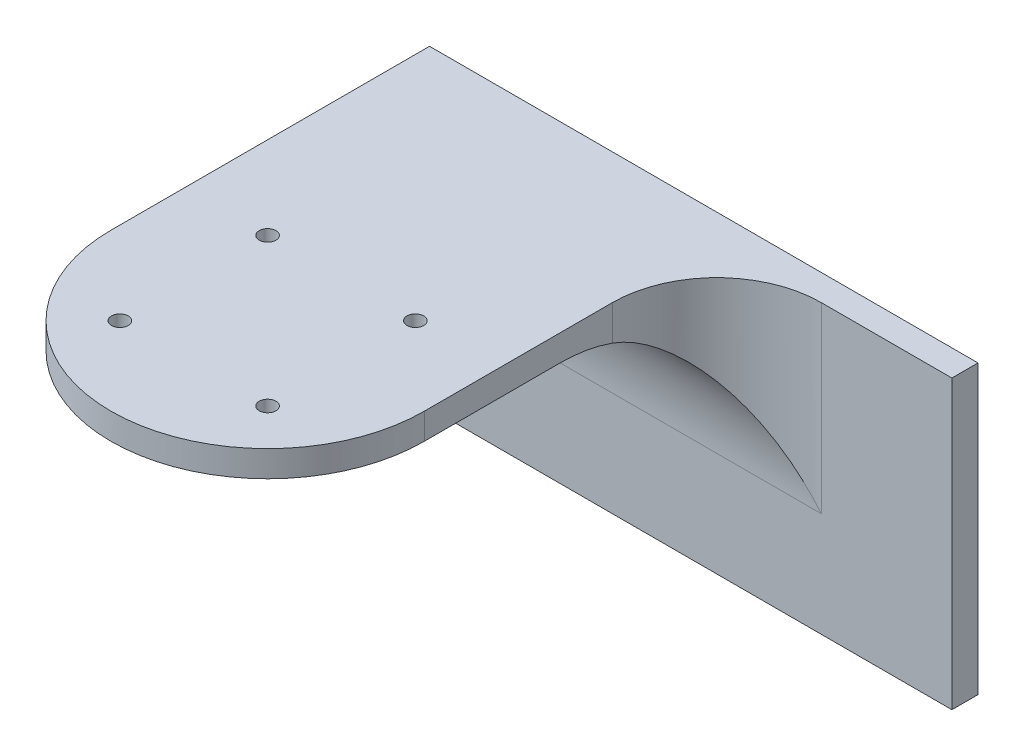
from build123d import *

# Parameters (mm, degrees)
SKETCH1_R           = 30
SKETCH1_R_2         = 1.6
BOSS_EXTRUDE1_DEPTH = 5
BOSS_EXTRUDE2_DEPTH = 5
SKETCH3_W           = 60
SKETCH3_H           = 5
BOSS_EXTRUDE3_DEPTH = 50
FILLET1_R           = 30
SKETCH4_W           = 5
SKETCH4_H           = 55
BOSS_EXTRUDE4_DEPTH = 45
FILLET2_R           = 20


with BuildPart() as part:
    # Sketch1 → Boss-Extrude1 (new body)
    with BuildSketch(Plane(origin=(0, 0, 0), x_dir=(1, 0, 0), z_dir=(0, 1, 0))):
        with Locations(Location((0, 0, 0), (0, 0, 270))):
            Circle(SKETCH1_R)
        with Locations(Location((14.142135624, 14.142135624, 0), (0, 0, 270))):
            Circle(SKETCH1_R_2, mode=Mode.SUBTRACT)
        with Locations(Location((-14.142135624, 14.142135624, 0), (0, 0, 270))):
            Circle(SKETCH1_R_2, mode=Mode.SUBTRACT)
        with Locations(Location((-14.142135624, -14.142135624, 0), (0, 0, 270))):
            Circle(SKETCH1_R_2, mode=Mode.SUBTRACT)
        with Locations(Location((14.142135624, -14.142135624, 0), (0, 0, 270))):
            Circle(SKETCH1_R_2, mode=Mode.SUBTRACT)
    extrude(amount=BOSS_EXTRUDE1_DEPTH)

    # Sketch2 → Boss-Extrude2 (add)
    with BuildSketch(Plane.XZ):
        with BuildLine():
            Line((-30, -61), (30, -61))
            Line((30, -61), (30, 0))
            ThreePointArc((30, 0), (0, -30), (-30, 0))
            Line((-30, 0), (-30, -61))
        make_face()
    extrude(amount=-BOSS_EXTRUDE2_DEPTH)

    # Sketch3 → Boss-Extrude3 (add)
    with BuildSketch(Plane.XZ):
        with Locations((0, -58.5)):
            Rectangle(SKETCH3_W, SKETCH3_H)
    extrude(amount=BOSS_EXTRUDE3_DEPTH)

    # Fillet1
    fillet1_edges = [part.edges().sort_by_distance(p)[0] for p in [
        (0, 0, -56),
    ]]
    fillet(fillet1_edges, radius=FILLET1_R)

    # Sketch4 → Boss-Extrude4 (add)
    with BuildSketch(Plane(origin=(30, 0, 0), x_dir=(0, 0, -1), z_dir=(1, 0, 0))):
        with Locations((58.5, -22.5)):
            Rectangle(SKETCH4_W, SKETCH4_H)
    extrude(amount=BOSS_EXTRUDE4_DEPTH)

    # Fillet2
    fillet2_edges = [part.edges().sort_by_distance(p)[0] for p in [
        (30, -12.5, -56),
    ]]
    fillet(fillet2_edges, radius=FILLET2_R)


solid = part.part
